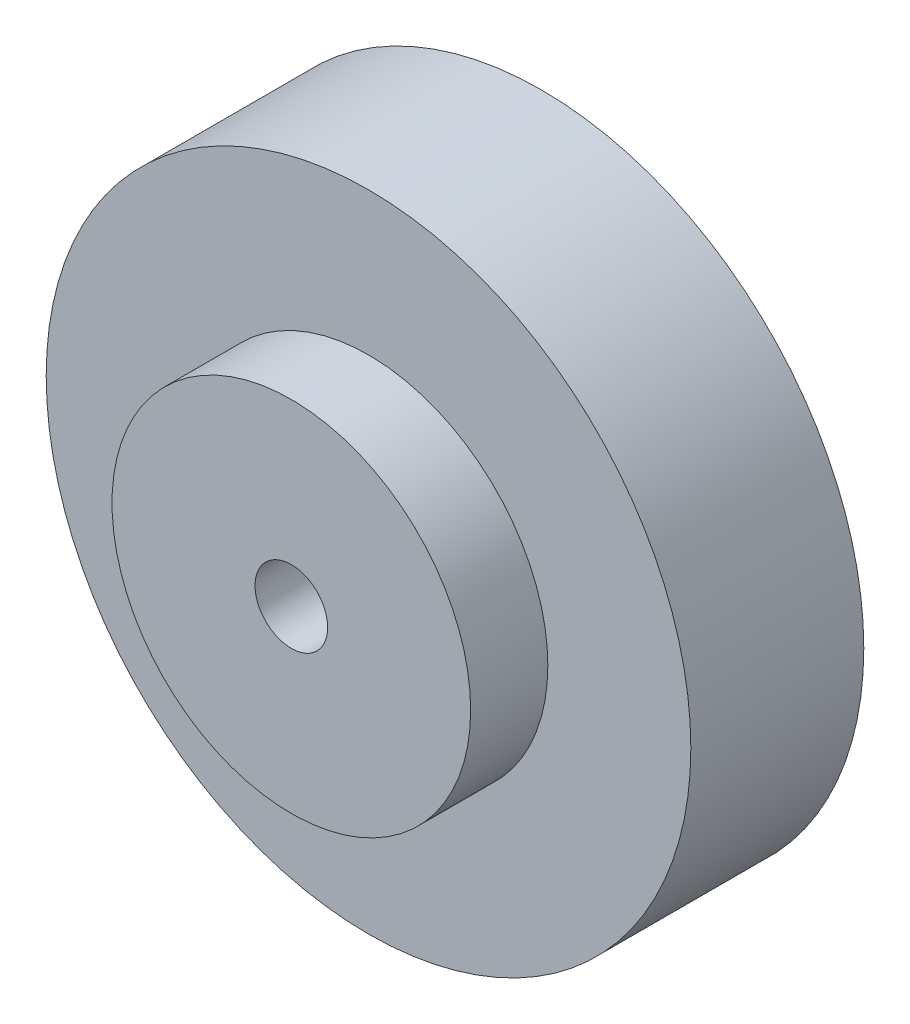
from build123d import *

# Parameters (mm, degrees)
SKETCH1_R           = 14.2
BOSS_EXTRUDE1_DEPTH = 7.62
SKETCH2_R           = 7.9
BOSS_EXTRUDE2_DEPTH = 3.4
SKETCH3_R           = 1.6
CUT_EXTRUDE1_DEPTH  = 23.90677629


with BuildPart() as part:
    # Sketch1 → Boss-Extrude1 (new body)
    with BuildSketch(Plane.XY):
        Circle(SKETCH1_R)
    extrude(amount=BOSS_EXTRUDE1_DEPTH)

    # Sketch2 → Boss-Extrude2 (add)
    with BuildSketch(Plane.XY.offset(7.62)):
        Circle(SKETCH2_R)
    extrude(amount=BOSS_EXTRUDE2_DEPTH)

    # Sketch3 → Cut-Extrude1 (cut, through all)
    with BuildSketch(Plane(origin=(0, 0, 0), x_dir=(-1, 0, 0), z_dir=(0, 0, -1))):
        Circle(SKETCH3_R)
    extrude(amount=-CUT_EXTRUDE1_DEPTH, mode=Mode.SUBTRACT)


solid = part.part
